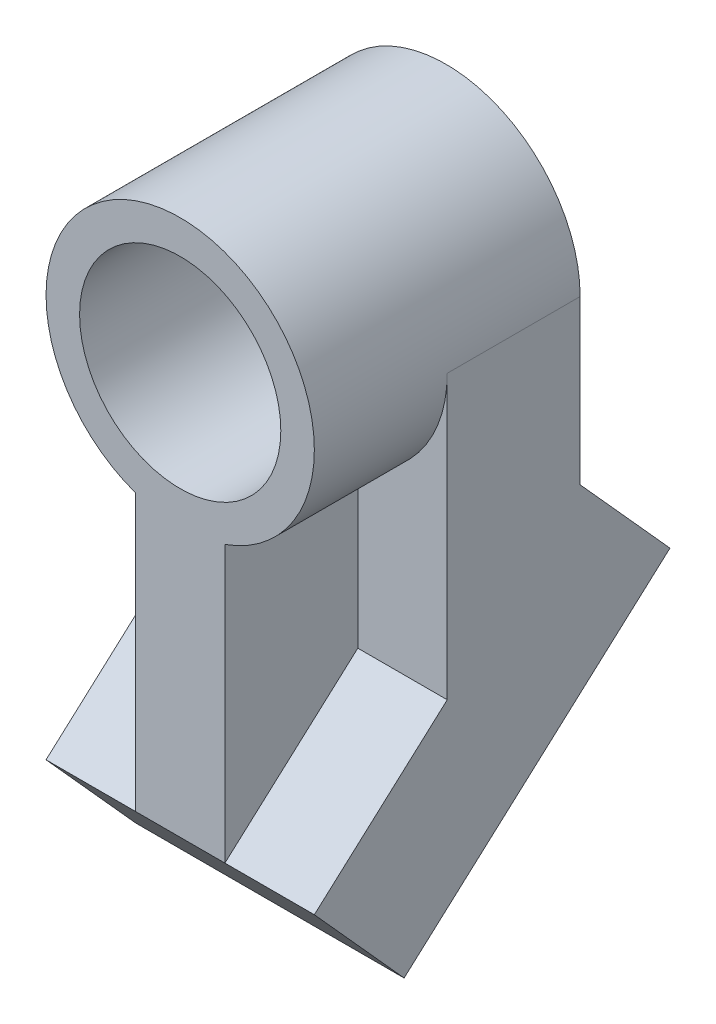
from build123d import *
from build123d.topology import SkipClean

# Parameters (mm, degrees)
SKETCH_1_R               = 11.25
EXTRUDE_1_DEPTH          = 14.86
EXTRUDE_START            = 14.86
SKETCH_2_R               = 11.25
EXTRUDE_2_DEPTH          = 14.86
EXTRUDE_4_DEPTH          = 10
EXTRUDE_5_DEPTH          = 20
HOLE_WIZARD_M3_5_1_D     = 2.9
HOLE_WIZARD_M3_5_1_DEPTH = 10
HOLE_WIZARD_M3_5_1_TIP   = 0.871247898


with BuildPart() as part:
    # 스케치1 → 보스-돌출1 (new body)
    with BuildSketch(Plane.XY):
        with BuildLine():
            Line((-5, -14.142135624), (-5, -45))
            Line((-5, -45), (5, -45))
            Line((5, -45), (5, -14.142135624))
            ThreePointArc((5, -14.142135624), (0, 15), (-5, -14.142135624))
        make_face()
        Circle(SKETCH_1_R, mode=Mode.SUBTRACT)
    extrude(amount=EXTRUDE_1_DEPTH)

    # 스케치2 → 보스-돌출2 (add)
    with SkipClean():  # the faces are left unmerged after this step: merging them gives an invalid solid
        with BuildSketch(Plane(origin=(0, 0, 0), x_dir=(-1, 0, 0), z_dir=(0, 0, -1)).offset(EXTRUDE_START)):
            with BuildLine():
                Line((-15, -32), (15, -32))
                Line((15, -32), (15, 0))
                ThreePointArc((15, 0), (0, 15), (-15, 0))
                Line((-15, 0), (-15, -32))
            make_face()
            Circle(SKETCH_2_R, mode=Mode.SUBTRACT)
        extrude(amount=-EXTRUDE_2_DEPTH)

    # 스케치4 → 보스-돌출4 (add)
    with SkipClean():  # the faces are left unmerged after this step: merging them gives an invalid solid
        with BuildSketch(Plane.ZY.offset(5)):
            Polygon((14.86, -45), (-14.865793019, -18.234775746), (-24.902752114, -29.381948128), (4.823040905, -56.147172382), align=None)
        extrude(amount=EXTRUDE_4_DEPTH)

    # 스케치4<2> → 보스-돌출5 (add)
    with SkipClean():  # the faces are left unmerged after this step: merging them gives an invalid solid
        with BuildSketch(Plane.ZY.offset(5)):
            Polygon((14.86, -45), (-14.865793019, -18.234775746), (-24.902752114, -29.381948128), (4.823040905, -56.147172382), align=None)
        extrude(amount=-EXTRUDE_5_DEPTH)

    # M3.5 나사 구멍1
    with Locations(Plane(origin=(0, -28.609765123, -25.760348223), x_dir=(-1, 0, 0), z_dir=(0, -0.7431448254773957, -0.6691306063588566))):
        with Locations((10, -31.154009393), (-10, -31.154009393), (-10, -11.154009393), (10, -11.154009393)):
            Hole(HOLE_WIZARD_M3_5_1_D / 2, depth=HOLE_WIZARD_M3_5_1_DEPTH)
            with Locations((0, 0, -(HOLE_WIZARD_M3_5_1_DEPTH + HOLE_WIZARD_M3_5_1_TIP / 2))):  # 118° drill point
                Cone(0, HOLE_WIZARD_M3_5_1_D / 2, HOLE_WIZARD_M3_5_1_TIP, mode=Mode.SUBTRACT)


solid = part.part
